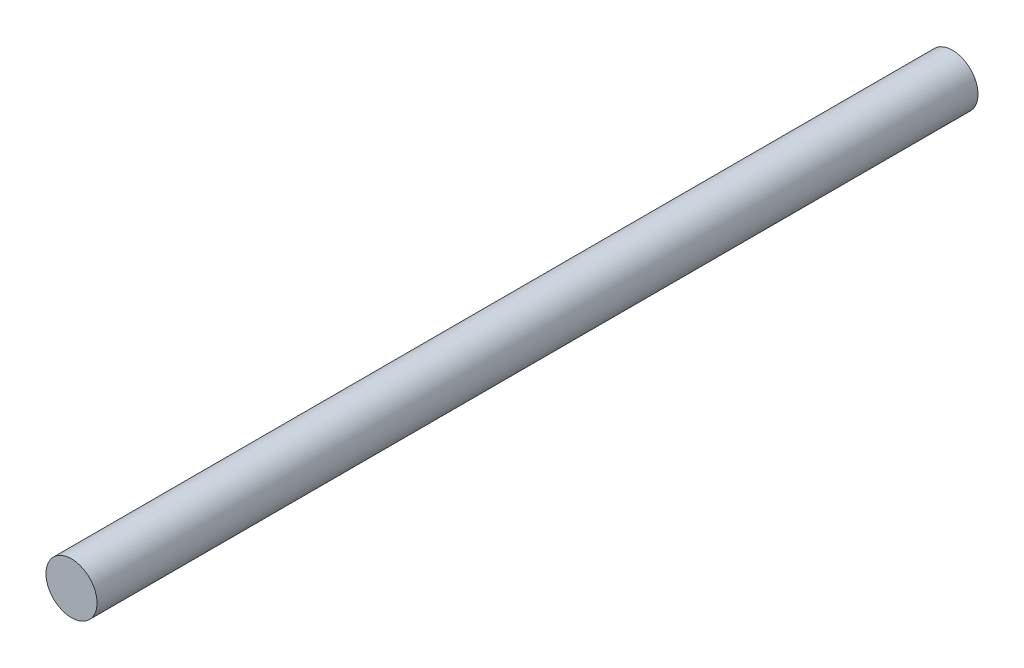
from build123d import *

# Parameters (mm, degrees)
SKETCH1_R           = 4
BOSS_EXTRUDE1_DEPTH = 138


with BuildPart() as part:
    # Sketch1 → Boss-Extrude1 (new body)
    with BuildSketch(Plane.XY):
        Circle(SKETCH1_R)
    extrude(amount=BOSS_EXTRUDE1_DEPTH)


solid = part.part
